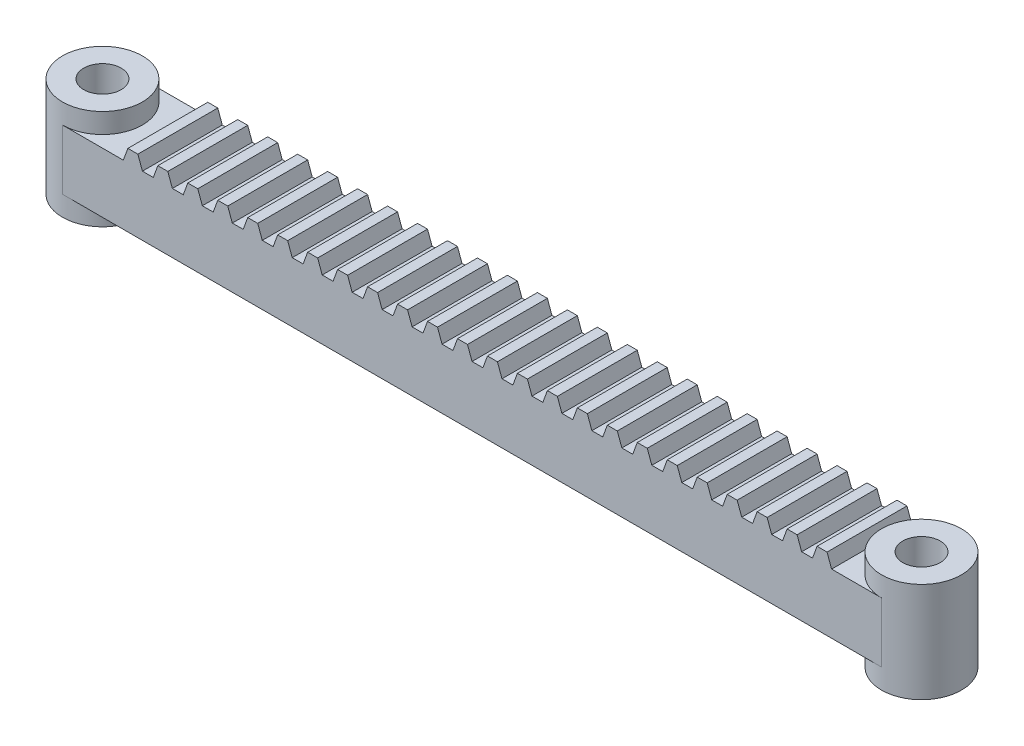
from build123d import *
from build123d.topology import SkipClean

# Parameters (mm, degrees)
SKETCH2_R           = 3.75
BOSS_EXTRUDE1_DEPTH = 12
BOSS_EXTRUDE2_START = 8
BOSS_EXTRUDE2_DEPTH = 16
BOSS_EXTRUDE3_START = -4
SKETCH2_3_R         = 8
SKETCH2_3_R_2       = 3.75
BOSS_EXTRUDE3_DEPTH = 20


with BuildPart() as part:
    # Sketch2 → Boss-Extrude1 (new body)
    with BuildSketch(Plane(origin=(0, 0, 0), x_dir=(1, 0, 0), z_dir=(0, 1, 0))):
        with BuildLine():
            Line((-82, 8), (82, 8))
            ThreePointArc((82, 8), (90, 0), (82, -8))
            Line((82, -8), (-82, -8))
            ThreePointArc((-82, -8), (-90, 0), (-82, 8))
        make_face()
        with Locations(Location((-82, 0, 0), (0, 0, 270))):
            Circle(SKETCH2_R, mode=Mode.SUBTRACT)
        with Locations(Location((82, 0, 0), (0, 0, 270))):
            Circle(SKETCH2_R, mode=Mode.SUBTRACT)
    extrude(amount=BOSS_EXTRUDE1_DEPTH)

    # Sketch3 → Boss-Extrude2 (add)
    with BuildSketch(Plane.XY.offset(BOSS_EXTRUDE2_START)):
        Polygon((69.090074414, 14.5), (71.090074414, 14.5), (72, 12), (68.180148829, 12), align=None)
        Polygon((66, 12), (62.180148829, 12), (63.090074414, 14.5), (65.090074414, 14.5), align=None)
        Polygon((60, 12), (56.180148829, 12), (57.090074414, 14.5), (59.090074414, 14.5), align=None)
        Polygon((54, 12), (50.180148829, 12), (51.090074414, 14.5), (53.090074414, 14.5), align=None)
        Polygon((48, 12), (44.180148829, 12), (45.090074414, 14.5), (47.090074414, 14.5), align=None)
        Polygon((42, 12), (38.180148829, 12), (39.090074414, 14.5), (41.090074414, 14.5), align=None)
        Polygon((36, 12), (32.180148829, 12), (33.090074414, 14.5), (35.090074414, 14.5), align=None)
        Polygon((30, 12), (26.180148829, 12), (27.090074414, 14.5), (29.090074414, 14.5), align=None)
        Polygon((24, 12), (20.180148829, 12), (21.090074414, 14.5), (23.090074414, 14.5), align=None)
        Polygon((18, 12), (14.180148829, 12), (15.090074414, 14.5), (17.090074414, 14.5), align=None)
        Polygon((12, 12), (8.180148829, 12), (9.090074414, 14.5), (11.090074414, 14.5), align=None)
        Polygon((6, 12), (2.180148829, 12), (3.090074414, 14.5), (5.090074414, 14.5), align=None)
        Polygon((0, 12), (-3.819851171, 12), (-2.909925586, 14.5), (-0.909925586, 14.5), align=None)
        Polygon((-6, 12), (-9.819851171, 12), (-8.909925586, 14.5), (-6.909925586, 14.5), align=None)
        Polygon((-12, 12), (-15.819851171, 12), (-14.909925586, 14.5), (-12.909925586, 14.5), align=None)
        Polygon((-18, 12), (-21.819851171, 12), (-20.909925586, 14.5), (-18.909925586, 14.5), align=None)
        Polygon((-24, 12), (-27.819851171, 12), (-26.909925586, 14.5), (-24.909925586, 14.5), align=None)
        Polygon((-30, 12), (-33.819851171, 12), (-32.909925586, 14.5), (-30.909925586, 14.5), align=None)
        Polygon((-36, 12), (-39.819851171, 12), (-38.909925586, 14.5), (-36.909925586, 14.5), align=None)
        Polygon((-42, 12), (-45.819851171, 12), (-44.909925586, 14.5), (-42.909925586, 14.5), align=None)
        Polygon((-48, 12), (-51.819851171, 12), (-50.909925586, 14.5), (-48.909925586, 14.5), align=None)
        Polygon((-54, 12), (-57.819851171, 12), (-56.909925586, 14.5), (-54.909925586, 14.5), align=None)
        Polygon((-60, 12), (-63.819851171, 12), (-62.909925586, 14.5), (-60.909925586, 14.5), align=None)
        Polygon((-66, 12), (-69.819851171, 12), (-68.909925586, 14.5), (-66.909925586, 14.5), align=None)
    extrude(amount=-BOSS_EXTRUDE2_DEPTH)

    # Sketch2<3> → Boss-Extrude3 (add)
    # profile 1 of 2: a face of its own
    with SkipClean():  # the faces are left unmerged after this step: merging them gives an invalid solid
        with BuildSketch(Plane(origin=(0, 0, 0), x_dir=(1, 0, 0), z_dir=(0, 1, 0)).offset(BOSS_EXTRUDE3_START)):
            with Locations(Location((-82, 0, 0), (0, 0, 270))):
                Circle(SKETCH2_3_R)
            with Locations(Location((-82, 0, 0), (0, 0, 270))):
                Circle(SKETCH2_3_R_2, mode=Mode.SUBTRACT)
        # profile 2 of 2: a face of its own
        with BuildSketch(Plane(origin=(0, 0, 0), x_dir=(1, 0, 0), z_dir=(0, 1, 0)).offset(BOSS_EXTRUDE3_START)):
            with Locations(Location((82, 0, 0), (0, 0, 270))):
                Circle(SKETCH2_3_R)
            with Locations(Location((82, 0, 0), (0, 0, 270))):
                Circle(SKETCH2_3_R_2, mode=Mode.SUBTRACT)
        extrude(amount=BOSS_EXTRUDE3_DEPTH)


solid = part.part
